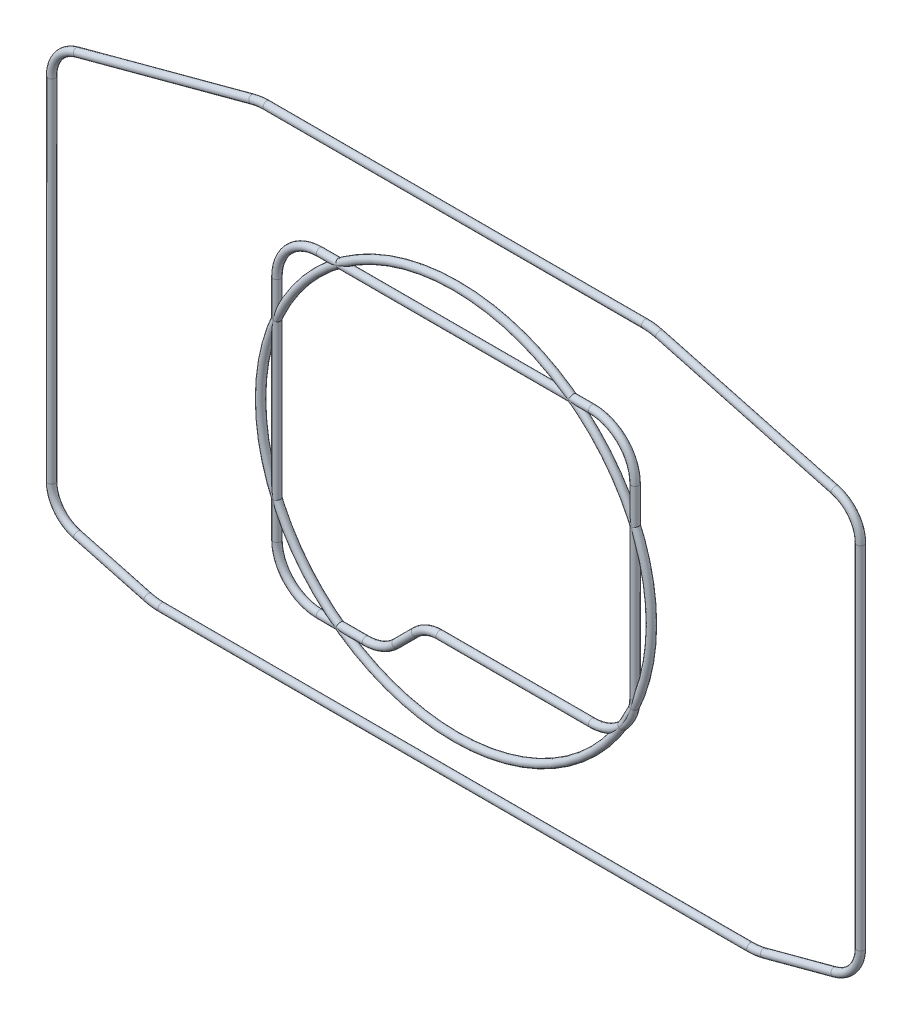
from build123d import *

# Parameters (mm, degrees)
SKETCH2_R = 1.5
SKETCH4_R = 1.5
SKETCH6_R = 1.5


with BuildPart() as part:
    # Sweep1: sweep along a path in Sketch1
    with BuildLine(Plane.XY) as sweep1_path:
        Line((55, -46.4), (-6.579689783, -46.4))
        ThreePointArc((-6.579689783, -46.4), (-11.784184463, -47.435238358), (-16.196342007, -50.383347776))
        Line((-16.196342007, -50.383347776), (-24.116652224, -58.303657993))
        ThreePointArc((-24.116652224, -58.303657993), (-29.761618494, -62.075503866), (-36.420310217, -63.4))
        Line((-36.420310217, -63.4), (-55, -63.4))
        ThreePointArc((-55, -63.4), (-67.303657993, -58.303657993), (-72.4, -46))
        Line((-72.4, -46), (-72.4, 46))
        ThreePointArc((-72.4, 46), (-67.303657993, 58.303657993), (-55, 63.4))
        Line((-55, 63.4), (55, 63.4))
        ThreePointArc((55, 63.4), (67.303657993, 58.303657993), (72.4, 46))
        Line((72.4, 46), (72.4, -29))
        ThreePointArc((72.4, -29), (67.303657993, -41.303657993), (55, -46.4))
    # Sketch2 → Sweep1 (sweep)
    with BuildSketch(Plane(origin=(0, 0, 0), x_dir=(1, 0, 0), z_dir=(0, 1, 0))):
        with Locations((72.4, 0)):
            Circle(SKETCH2_R)
    sweep(path=sweep1_path.line)


with BuildPart() as body_2:
    # Sweep2: sweep along a path in Sketch3
    with BuildLine(Plane.XY) as sweep2_path:
        Line((-163.5, 70.721918018), (-163.5, -71.109759074))
        ThreePointArc((-163.5, -71.109759074), (-160.606946764, -79.63241908), (-153.123466631, -84.632720642))
        Line((-153.123466631, -84.632720642), (-124.694018992, -92.250368178))
        ThreePointArc((-124.694018992, -92.250368178), (-121.871576229, -92.81178695), (-119, -93))
        Line((-119, -93), (119, -93))
        ThreePointArc((119, -93), (121.871576229, -92.81178695), (124.694018992, -92.250368178))
        Line((124.694018992, -92.250368178), (153.123466631, -84.632720642))
        ThreePointArc((153.123466631, -84.632720642), (160.606946764, -79.63241908), (163.5, -71.109759074))
        Line((163.5, -71.109759074), (163.5, 70.721918018))
        ThreePointArc((163.5, 70.721918018), (160.606946764, 79.244578024), (153.123466631, 84.244879586))
        Line((153.123466631, 84.244879586), (82.194017583, 103.250368178))
        ThreePointArc((82.194017583, 103.250368178), (79.37157482, 103.81178695), (76.499998591, 104))
        Line((76.499998591, 104), (-76.499998591, 104))
        ThreePointArc((-76.499998591, 104), (-79.37157482, 103.81178695), (-82.194017583, 103.250368178))
        Line((-82.194017583, 103.250368178), (-153.123466631, 84.244879586))
        ThreePointArc((-153.123466631, 84.244879586), (-160.606946764, 79.244578024), (-163.5, 70.721918018))
    # Sketch4 → Sweep2 (sweep)
    with BuildSketch(Plane(origin=(0, 0, 0), x_dir=(1, 0, 0), z_dir=(0, 1, 0))):
        with Locations((163.5, 0)):
            Circle(SKETCH4_R)
    sweep(path=sweep2_path.line)


with BuildPart() as body_3:
    # Sketch6 → Revolve1 (revolve)
    with BuildSketch(Plane(origin=(0, 0, 0), x_dir=(0, 0, -1), z_dir=(1, 0, 0)), mode=Mode.PRIVATE) as revolve1_sk:
        with Locations((0, 79)):
            Circle(SKETCH6_R)
    revolve(revolve1_sk.sketch.rotate(Axis((0, 0, 0), (0, 0, -1)), 90), axis=Axis((0, 0, 0), (0, 0, -1)))


solid = Compound([part.part, body_2.part, body_3.part])
